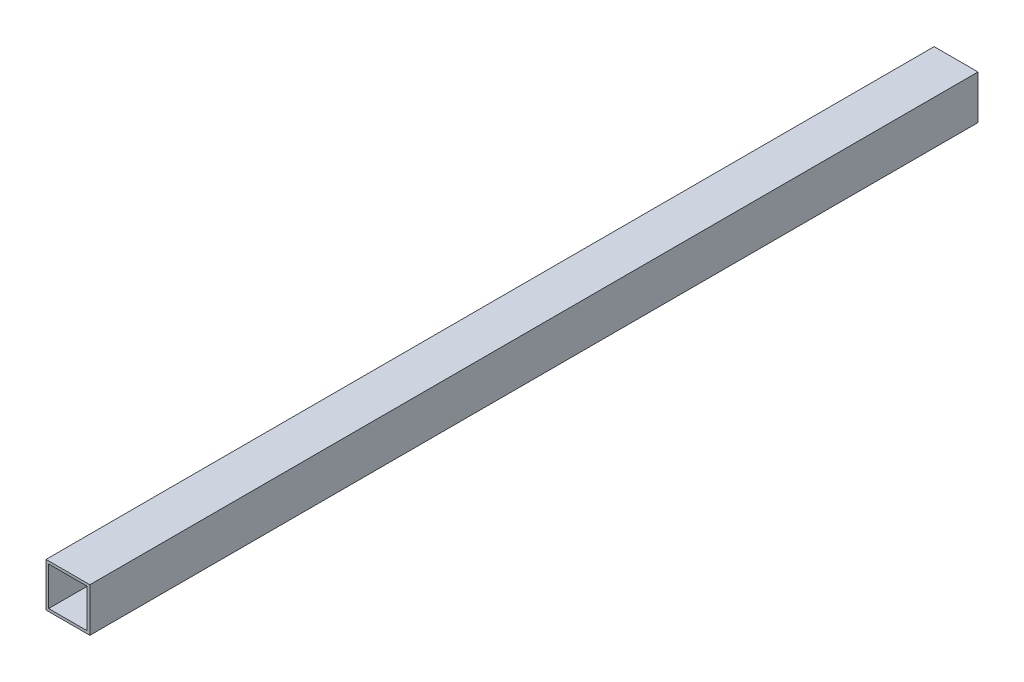
from build123d import *

# Parameters (mm, degrees)
SKETCH1_W           = 25.4
SKETCH1_H           = 25.4
SKETCH1_W_2         = 22.352
SKETCH1_H_2         = 22.352
EXTRUDE_THIN1_DEPTH = 514.35


with BuildPart() as part:
    # Sketch1 → Extrude-Thin1 (new body)
    with BuildSketch(Plane.XY):
        with Locations((12.7, 12.7)):
            Rectangle(SKETCH1_W, SKETCH1_H)
        with Locations((12.7, 12.7)):
            Rectangle(SKETCH1_W_2, SKETCH1_H_2, mode=Mode.SUBTRACT)
    extrude(amount=EXTRUDE_THIN1_DEPTH)


solid = part.part
